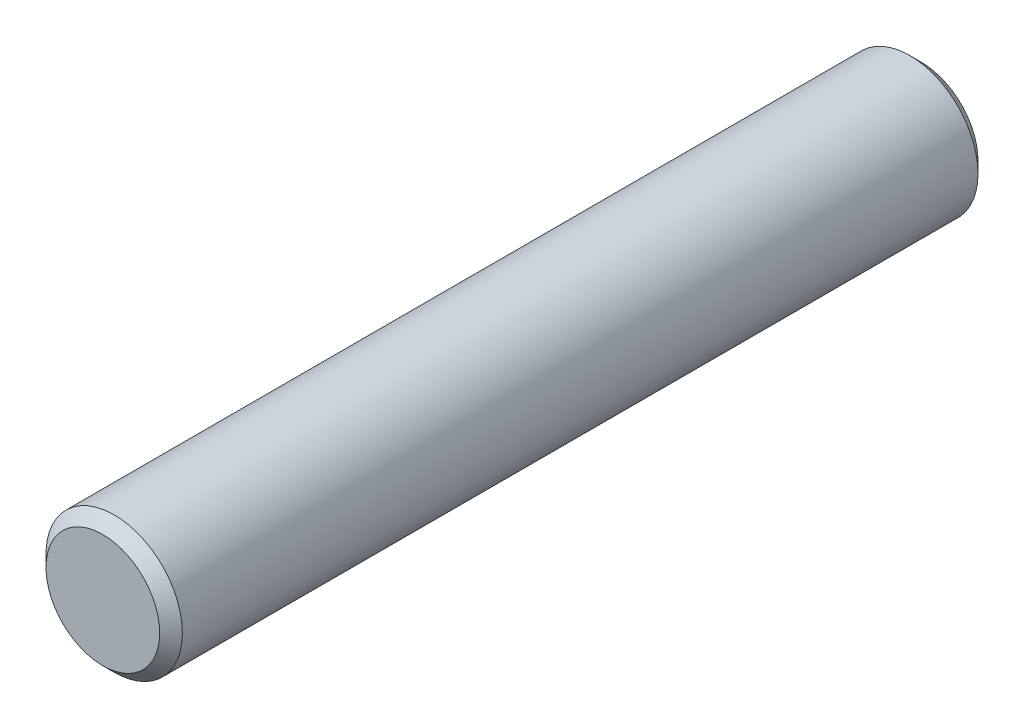
from build123d import *

# Parameters (mm, degrees)
SKETCH1_R           = 3
BOSS_EXTRUDE1_DEPTH = 36
CHAMFER1_SIZE       = 0.5


with BuildPart() as part:
    # Sketch1 → Boss-Extrude1 (new body)
    with BuildSketch(Plane.XY):
        Circle(SKETCH1_R)
    extrude(amount=BOSS_EXTRUDE1_DEPTH)

    # Chamfer1
    chamfer1_edges = [part.edges().sort_by_distance(p)[0] for p in [
        (-3, 0, 0),
        (-3, 0, 36),
    ]]
    chamfer(chamfer1_edges, length=CHAMFER1_SIZE)


solid = part.part
